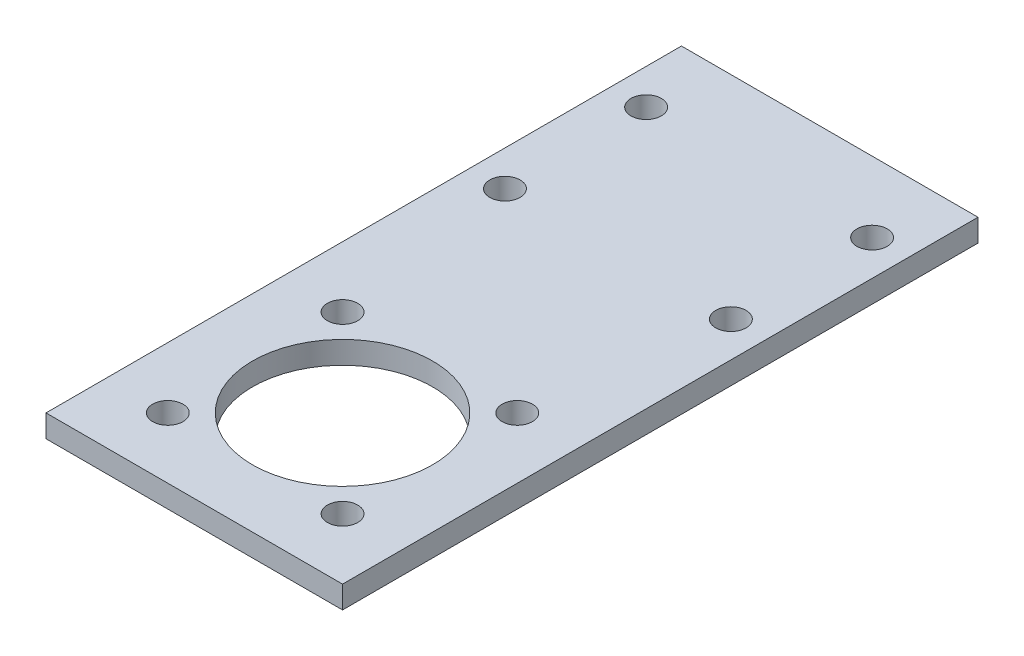
from build123d import *

# Parameters (mm, degrees)
SKETCH1_W            = 42
SKETCH1_H            = 90
SKETCH1_R            = 12.75
BOSS_EXTRUDE1_DEPTH  = 3.175
M4_CLEARANCE_HOLE1_D = 4.3


with BuildPart() as part:
    # Sketch1 → Boss-Extrude1 (new body)
    with BuildSketch(Plane(origin=(0, 0, 0), x_dir=(1, 0, 0), z_dir=(0, 1, 0))):
        with Locations((21, 45)):
            Rectangle(SKETCH1_W, SKETCH1_H)
        with Locations((21, 21)):
            Circle(SKETCH1_R, mode=Mode.SUBTRACT)
    extrude(amount=BOSS_EXTRUDE1_DEPTH)

    # M4 Clearance Hole1 (through all)
    with Locations(Plane(origin=(0, 3.175, 0), x_dir=(1, 0, 0), z_dir=(0, 1, 0))):
        with Locations((8.625631329, 33.374368671), (21, 21), (5, 80), (33.374368671, 33.374368671), (33.374368671, 8.625631329), (8.625631329, 8.625631329), (37, 80), (37, 60), (5, 60)):
            Hole(M4_CLEARANCE_HOLE1_D / 2)


solid = part.part
